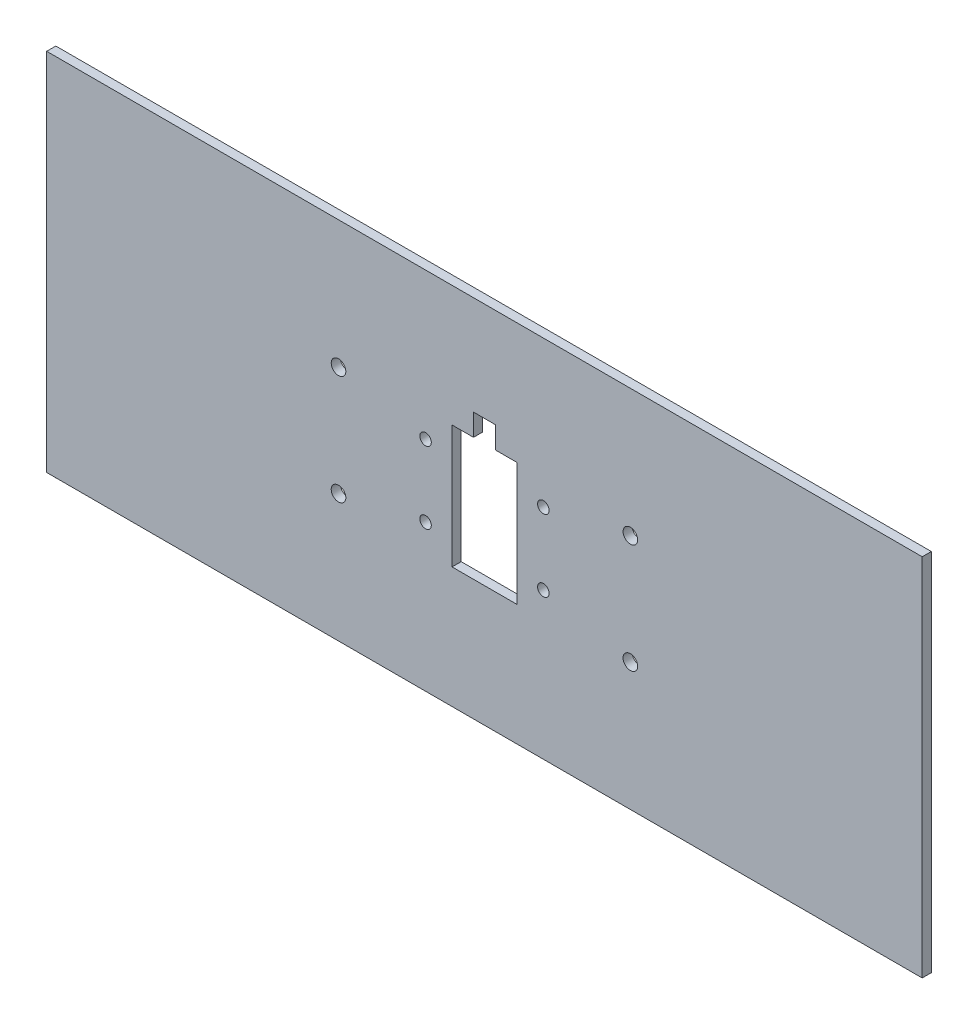
from build123d import *

# Parameters (mm, degrees)
SKETCH1_W               = 304.8
SKETCH1_H               = 127
BOSS_EXTRUDE1_DEPTH     = 3.175
SKETCH2_R               = 2.54
CUT_EXTRUDE1_DEPTH      = 166.130526024
CUT_EXTRUDE2_DEPTH      = 166.130526024
CUT_EXTRUDE2_DEPTH_BACK = 166.130526024
SKETCH3_R               = 2


with BuildPart() as part:
    # Sketch1 → Boss-Extrude1 (new body)
    with BuildSketch(Plane.XY):
        Rectangle(SKETCH1_W, SKETCH1_H)
    extrude(amount=BOSS_EXTRUDE1_DEPTH)

    # Sketch2 → Cut-Extrude1 (cut, through all)
    with BuildSketch(Plane.XY.offset(3.175)):
        with Locations((50.8, 19.05)):
            Circle(SKETCH2_R)
        with Locations((50.8, -19.05)):
            Circle(SKETCH2_R)
        with Locations((-50.8, -19.05)):
            Circle(SKETCH2_R)
        with Locations((-50.8, 19.05)):
            Circle(SKETCH2_R)
    extrude(amount=-CUT_EXTRUDE1_DEPTH, mode=Mode.SUBTRACT)

    # Sketch3 → Cut-Extrude2 (cut, two sides: drawn at the far end of the back side and taken through both)
    with BuildSketch(Plane(origin=(0, 0, 0), x_dir=(-1, 0, 0), z_dir=(0, 0, -1)).offset(-CUT_EXTRUDE2_DEPTH_BACK)):
        with Locations((-20.5, 12.5)):
            Circle(SKETCH3_R)
        with Locations((20.5, -12.5)):
            Circle(SKETCH3_R)
        with Locations((20.5, 12.5)):
            Circle(SKETCH3_R)
        with Locations((-20.5, -12.5)):
            Circle(SKETCH3_R)
        Polygon((11.27, 21.395), (11.27, -21.395), (-11.27, -21.395), (-11.27, 21.395), (-3.81, 21.395), (-3.81, 29.015), (3.81, 29.015), (3.81, 21.395), align=None)
    extrude(amount=CUT_EXTRUDE2_DEPTH + CUT_EXTRUDE2_DEPTH_BACK, mode=Mode.SUBTRACT)


solid = part.part
